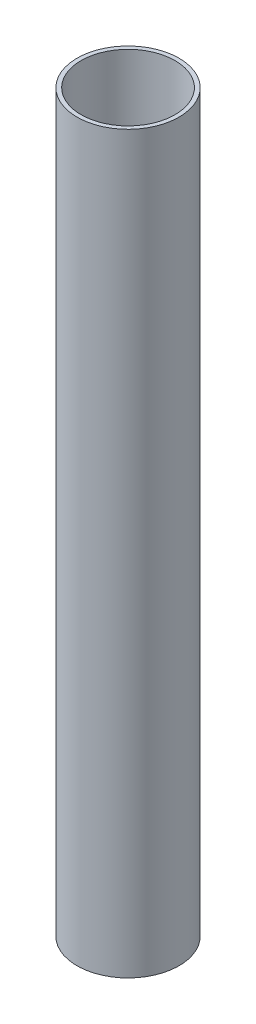
from build123d import *

# Parameters (mm, degrees)
SKETCH_1_R      = 12.5
SKETCH_1_R_2    = 11.5
EXTRUDE_1_DEPTH = 180


with BuildPart() as part:
    # 草图1 → 凸台-拉伸1 (new body)
    with BuildSketch(Plane(origin=(0, 0, 0), x_dir=(1, 0, 0), z_dir=(0, 1, 0))):
        with Locations(Location((0, 0, 0), (0, 0, 90))):
            Circle(SKETCH_1_R)
        with Locations(Location((0, 0, 0), (0, 0, 90))):
            Circle(SKETCH_1_R_2, mode=Mode.SUBTRACT)
    extrude(amount=EXTRUDE_1_DEPTH)


solid = part.part
